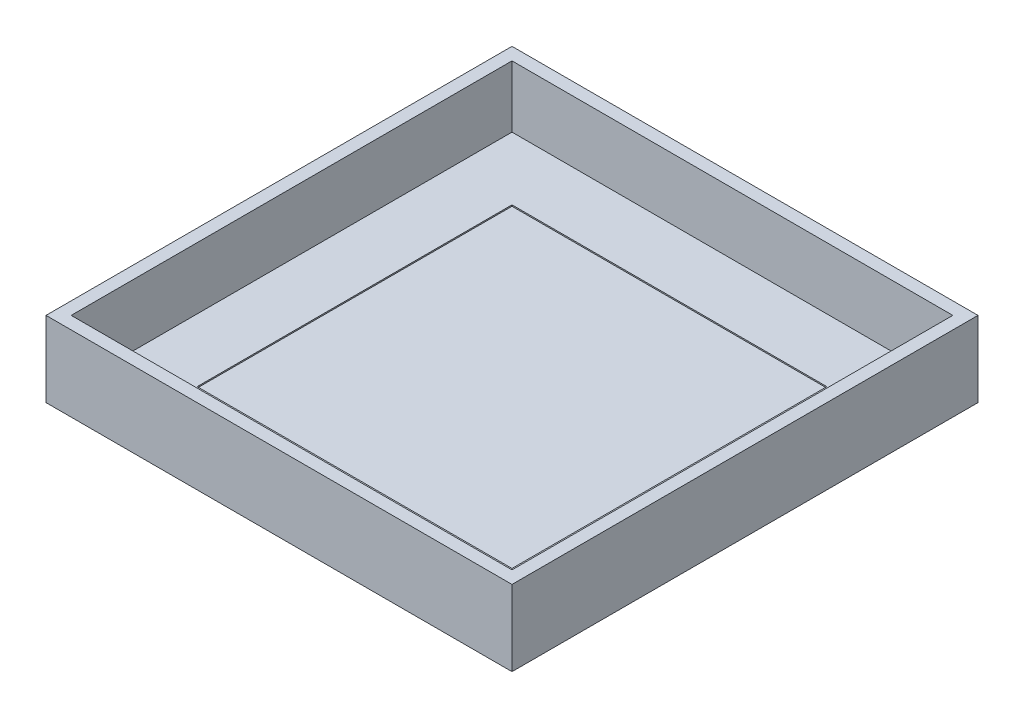
from build123d import *

# Parameters (mm, degrees)
SKETCH_1_W      = 370
SKETCH_1_H      = 370
SKETCH_1_W_2    = 350
SKETCH_1_H_2    = 350
EXTRUDE_1_DEPTH = 50
SKETCH_2_W      = 370
SKETCH_2_H      = 370
EXTRUDE_2_DEPTH = 10
SKETCH_3_W      = 350
SKETCH_3_H      = 350
SKETCH_3_W_2    = 250
SKETCH_3_H_2    = 250
EXTRUDE_3_DEPTH = 1


with BuildPart() as part:
    # 草图1 → 凸台-拉伸1 (new body)
    with BuildSketch(Plane(origin=(0, 0, 0), x_dir=(1, 0, 0), z_dir=(0, 1, 0))):
        Rectangle(SKETCH_1_W, SKETCH_1_H)
        Rectangle(SKETCH_1_W_2, SKETCH_1_H_2, mode=Mode.SUBTRACT)
    extrude(amount=EXTRUDE_1_DEPTH)

    # 草图2 → 凸台-拉伸2 (add)
    with BuildSketch(Plane.XZ):
        Rectangle(SKETCH_2_W, SKETCH_2_H)
    extrude(amount=EXTRUDE_2_DEPTH)

    # 草图3 → 凸台-拉伸3 (add)
    with BuildSketch(Plane(origin=(0, 0, 0), x_dir=(1, 0, 0), z_dir=(0, 1, 0))):
        Rectangle(SKETCH_3_W, SKETCH_3_H)
        Rectangle(SKETCH_3_W_2, SKETCH_3_H_2, mode=Mode.SUBTRACT)
    extrude(amount=EXTRUDE_3_DEPTH)


solid = part.part
